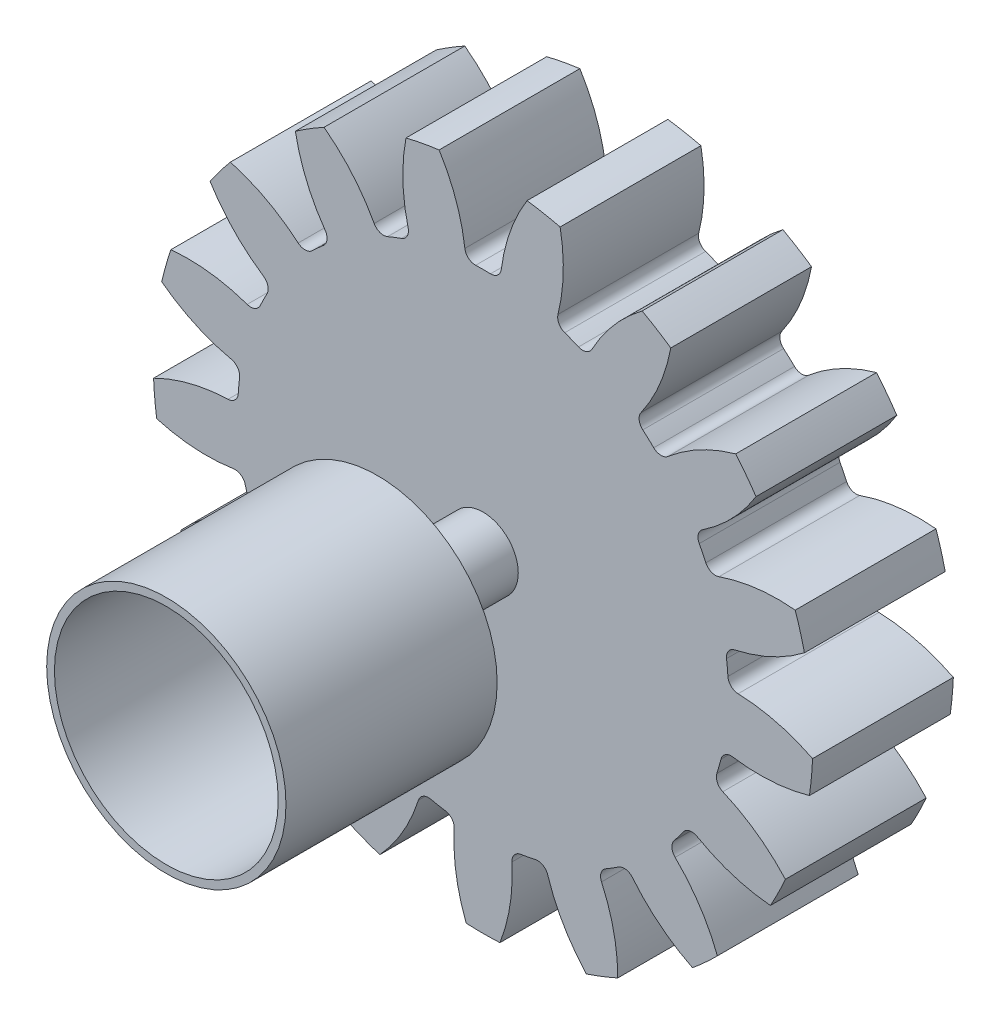
from build123d import *

# Parameters (mm, degrees)
SKETCH1_R                = 4.685
BOSS_EXTRUDE1_DEPTH      = 1
CUT_EXTRUDE1_DEPTH       = 7.700630567
FILLET1_R                = 0.15
CIRPATTERN1_COUNT        = 17
FILLET1_OF_CIRPATTERN1_R = 0.15
SKETCH4_R                = 0.5
BOSS_EXTRUDE2_DEPTH      = 1.5
SKETCH5_R                = 1.7
BOSS_EXTRUDE3_DEPTH      = 3
SKETCH6_R                = 1.59
CUT_EXTRUDE2_DEPTH       = 2.5


with BuildPart() as part:
    # Sketch1 → Boss-Extrude1 (new, symmetric)
    with BuildSketch(Plane.XY):
        Circle(SKETCH1_R)
    extrude(amount=BOSS_EXTRUDE1_DEPTH, both=True)

    # Sketch3 → Cut-Extrude1 (cut, symmetric)
    with BuildSketch(Plane.XY):
        with BuildLine():
            ThreePointArc((0.245193984, 3.476363748), (0, 3.485), (-0.245193984, 3.476363748))
            ThreePointArc((-0.245193984, 3.476363748), (-0.363341574, 4.083017365), (-0.624470365, 4.643195211))
            ThreePointArc((-0.624470365, 4.643195211), (0, 4.685), (0.624470365, 4.643195211))
            ThreePointArc((0.624470365, 4.643195211), (0.363341574, 4.083017365), (0.245193984, 3.476363748))
        make_face()
    cut_extrude1 = extrude(amount=CUT_EXTRUDE1_DEPTH, both=True, mode=Mode.SUBTRACT)

    # Fillet1
    fillet1_edges = [part.edges().sort_by_distance(p)[0] for p in [
        (0.245193984, 3.476363748, 0),
        (-0.245193984, 3.476363748, 0),
    ]]
    fillet(fillet1_edges, radius=FILLET1_R)

    # CirPattern1: Cut-Extrude1 ×17 about axis
    cirpattern1_axis = Axis((0, 0, 0), (0, 0, 1))
    for i in range(1, CIRPATTERN1_COUNT):
        add(cut_extrude1.rotate(cirpattern1_axis, i * 360 / CIRPATTERN1_COUNT), mode=Mode.SUBTRACT)

    # Fillet1 of CirPattern1
    fillet1_of_cirpattern1_edges = [part.edges().sort_by_distance(p)[0] for p in [
        (-1.027170851, 3.330186938, 0),
        (-1.484444014, 3.153038371, 0),
        (-2.160810572, 2.734249929, 0),
        (-2.523211654, 2.40387769, 0),
        (-3.002620851, 1.769037315, 0),
        (-3.221205578, 1.330060007, 0),
        (-3.438910547, 0.56490641, 0),
        (-3.48415784, 0.07661035, 0),
        (-3.410756317, -0.715518236, 0),
        (-3.276555279, -1.18718596, 0),
        (-2.921960547, -1.89930818, 0),
        (-2.626435772, -2.290646227, 0),
        (-2.038537814, -2.826586029, 0),
        (-1.62160156, -3.084742028, 0),
        (-0.879799253, -3.372117773, 0),
        (-0.397761072, -3.462226326, 0),
        (0.397761072, -3.462226326, 0),
        (0.879799253, -3.372117773, 0),
        (1.62160156, -3.084742028, 0),
        (2.038537814, -2.826586029, 0),
        (2.626435772, -2.290646227, 0),
        (2.921960547, -1.89930818, 0),
        (3.276555279, -1.18718596, 0),
        (3.410756317, -0.715518236, 0),
        (3.48415784, 0.07661035, 0),
        (3.438910547, 0.56490641, 0),
        (3.221205578, 1.330060007, 0),
        (3.002620851, 1.769037315, 0),
        (2.523211654, 2.40387769, 0),
        (2.160810572, 2.734249929, 0),
        (1.484444014, 3.153038371, 0),
        (1.027170851, 3.330186938, 0),
    ]]
    fillet(fillet1_of_cirpattern1_edges, radius=FILLET1_OF_CIRPATTERN1_R)

    # Sketch4 → Boss-Extrude2 (add)
    with BuildSketch(Plane.XY.offset(1)):
        Circle(SKETCH4_R)
    extrude(amount=BOSS_EXTRUDE2_DEPTH)

    # Sketch5 → Boss-Extrude3 (add)
    with BuildSketch(Plane.XY.offset(2.5)):
        Circle(SKETCH5_R)
    extrude(amount=BOSS_EXTRUDE3_DEPTH)

    # Sketch6 → Cut-Extrude2 (cut)
    with BuildSketch(Plane.XY.offset(5.5)):
        Circle(SKETCH6_R)
    extrude(amount=-CUT_EXTRUDE2_DEPTH, mode=Mode.SUBTRACT)


solid = part.part
